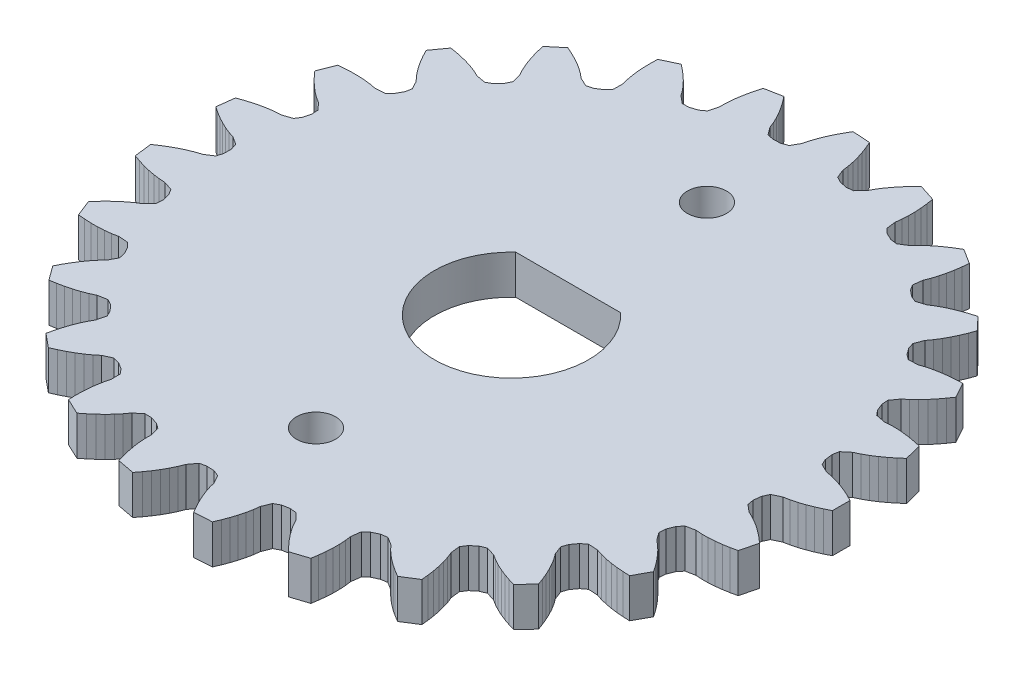
from build123d import *

# Parameters (mm, degrees)
EXTRUDE_1_DEPTH     = 2
SKETCH_2_R          = 1
CUT_EXTRUDE_1_DEPTH = 10


with BuildPart() as part:
    # Эскиз1 → Бобышка-Вытянуть1 (new body)
    with BuildSketch(Plane(origin=(0, 0, 0), x_dir=(1, 0, 0), z_dir=(0, 1, 0))):
        Polygon((32.943136139, 20.331579673), (33.080956161, 20.030160949), (33.512868966, 19.822081617), (33.823960281, 19.763235506), (34.136151921, 19.680300027), (34.448821434, 19.576608948), (34.761457482, 19.454041868), (35.073598037, 19.313820932), (35.384807371, 19.156809673), (35.384807371, 18.257142019), (35.073598037, 18.10013076), (34.761457482, 17.959909824), (34.448821434, 17.837342744), (34.136151921, 17.733651665), (33.823960281, 17.650716186), (33.512868966, 17.591870075), (33.080956161, 17.383790743), (32.943136139, 17.082372019), (32.893897512, 16.692608156), (32.952427876, 16.36638461), (33.319024121, 16.057430126), (33.605707497, 15.92306751), (33.887465848, 15.765098698), (34.164525351, 15.586907519), (34.436858169, 15.390441685), (34.704320726, 15.176999849), (34.966705734, 14.947526773), (34.742967486, 14.076123833), (34.402488254, 14.001439985), (34.06528264, 13.943250547), (33.731987435, 13.90228356), (33.403354086, 13.879607874), (33.080345306, 13.876916869), (32.764393064, 13.897284781), (32.294302368, 13.803154991), (32.085852427, 13.545480336), (31.941230392, 13.18020677), (31.91679342, 12.849676226), (32.195038514, 12.459259337), (32.439300581, 12.257822713), (32.672921728, 12.034746329), (32.896962554, 11.793251457), (33.111880469, 11.535231541), (33.317859372, 11.26198014), (33.514933439, 10.974463884), (33.081515241, 10.186079109), (32.733159672, 10.198415334), (32.392076868, 10.22591365), (32.059064669, 10.269120864), (31.735116728, 10.328885366), (31.421586637, 10.406607921), (31.120625909, 10.504910065), (30.64189485, 10.530644337), (30.375912666, 10.332904398), (30.144994356, 10.01507261), (30.039125513, 9.701003519), (30.211536293, 9.253655553), (30.398029167, 8.997801926), (30.568833836, 8.72363468), (30.725778675, 8.434010126), (30.869777605, 8.130648468), (31.001330441, 7.814756891), (31.120710679, 7.48726316), (30.50484579, 6.831433665), (30.170502346, 6.930014832), (29.846973838, 7.041473082), (29.535169028, 7.166139628), (29.236261334, 7.304589095), (28.951910181, 7.457841617), (28.684851437, 7.627901307), (28.227560448, 7.771882663), (27.92075866, 7.646502166), (27.618053522, 7.396082698), (27.437404936, 7.118209175), (27.4931482, 6.642038651), (27.610153847, 6.347844244), (27.707409752, 6.039813072), (27.787397182, 5.720257012), (27.851429145, 5.39061494), (27.900289966, 5.051931819), (27.934475275, 4.705038247), (27.174860751, 4.222972212), (26.875537461, 4.401604103), (26.589891736, 4.590018956), (26.318886156, 4.788311576), (26.063800179, 4.996746719), (25.826494792, 5.215899787), (25.610118315, 5.447031548), (25.20300067, 5.70021311), (24.874656764, 5.655070174), (24.519184874, 5.4877978), (24.275107362, 5.263579662), (24.210680554, 4.788506124), (24.25084708, 4.474456254), (24.268443274, 4.151915888), (24.266447392, 3.822507204), (24.246489023, 3.487297343), (24.209587725, 3.147103382), (24.156430116, 2.80260657), (23.300795331, 2.524593975), (23.055299777, 2.772052493), (22.825485006, 3.02558515), (22.612306934, 3.285044389), (22.417070665, 3.550368462), (22.241721815, 3.821651883), (22.089623335, 4.099332857), (21.758259733, 4.445806295), (21.429004762, 4.483737417), (21.043101728, 4.410122476), (20.750931576, 4.253648172), (20.57038287, 3.809522238), (20.531186464, 3.495349814), (20.468017314, 3.178566651), (20.384163528, 2.860003302), (20.281468886, 2.54028812), (20.161124112, 2.219958957), (20.023963674, 1.899504906), (19.126071308, 1.843014306), (18.949828879, 2.143750721), (18.79028517, 2.446470793), (18.648329368, 2.750793874), (18.525210219, 3.056335589), (18.422835719, 3.362703628), (18.344572142, 3.669486097), (18.109783377, 4.087481212), (17.800305643, 4.206103039), (17.408219172, 4.230771029), (17.086314505, 4.151872415), (16.800988441, 3.766600152), (16.684891956, 3.472045782), (16.544926613, 3.180924473), (16.384483764, 2.893222967), (16.20550553, 2.609091344), (16.009278985, 2.328754439), (15.796734013, 2.052478454), (14.913001946, 2.221059362), (14.817086602, 2.556177299), (14.737838672, 2.88906377), (14.676024746, 3.219128954), (14.632758746, 3.545690002), (14.609791162, 3.867892429), (14.610280077, 4.184500123), (14.486818791, 4.647752744), (14.216563918, 4.839611831), (13.842930243, 4.961012771), (13.511517516, 4.964647337), (13.139342179, 4.662436817), (12.953640387, 4.406008436), (12.745673386, 4.158841204), (12.518722689, 3.920078883), (12.274706725, 3.689383854), (12.014928044, 3.466653807), (11.740353519, 3.251915325), (10.926309888, 3.634975182), (10.916748343, 3.983417949), (10.922775631, 4.325554338), (10.944987576, 4.660622416), (10.984293287, 4.987683764), (11.042175757, 5.305475415), (11.121386444, 5.612014708), (11.117010163, 6.091416969), (10.902959259, 6.344458104), (10.571255159, 6.554963927), (10.251158252, 6.6409033), (9.815518788, 6.440743522), (9.571880013, 6.238553467), (9.308978688, 6.050870738), (9.02978029, 5.876049919), (8.736059014, 5.713286901), (8.429051048, 5.562158658), (8.109699499, 5.422450488), (7.416493657, 5.995920234), (7.493886698, 6.33579389), (7.584810488, 6.66568251), (7.689652646, 6.984699922), (7.809060346, 7.291711104), (7.944155902, 7.58512396), (8.097111261, 7.862333861), (8.212094964, 8.327763155), (8.067697633, 8.626086833), (7.798765297, 8.912470683), (7.510097076, 9.075314977), (7.038366314, 8.989782716), (6.752099278, 8.854535333), (6.450782684, 8.738129903), (6.136879647, 8.638235219), (5.811908649, 8.553631211), (5.476961837, 8.483600716), (5.132899295, 8.427701237), (4.604087916, 9.155547658), (4.763572653, 9.465496692), (4.933679869, 9.762409427), (5.114564622, 10.045331136), (5.306571486, 10.313001509), (5.510391576, 10.563599363), (5.72748086, 10.794061754), (5.954599697, 11.216273447), (5.888928957, 11.541134894), (5.699666392, 11.885402221), (5.460564943, 12.114919329), (4.982383462, 12.149388891), (4.671475374, 12.08958227), (4.350676342, 12.051768321), (4.021792348, 12.033076523), (3.685990751, 12.031947506), (3.344151033, 12.047415033), (2.996996213, 12.078836613), (2.66580646, 12.915326443), (2.897361882, 13.175875617), (3.135964061, 13.421156348), (3.381525755, 13.650205342), (3.634067285, 13.861716194), (3.893805144, 14.05375306), (4.161387835, 14.222987141), (4.486371095, 14.575452119), (4.503553277, 14.906439096), (4.405852547, 15.286958318), (4.231341494, 15.568726836), (3.776755194, 15.721032372), (3.460741554, 15.740424383), (3.140617067, 15.783577904), (2.817417108, 15.847263466), (2.49188456, 15.929680381), (2.164630983, 16.029674048), (1.836196899, 16.146442354), (1.723438643, 17.03901586), (2.012515269, 17.233793911), (2.30462016, 17.412030748), (2.59942925, 17.572815037), (2.896637333, 17.714876361), (3.195972677, 17.836285857), (3.49723557, 17.933658029), (3.899663359, 18.194229622), (3.998618845, 18.510544999), (3.998618845, 18.903406693), (3.899663359, 19.21972207), (3.49723557, 19.480293663), (3.195972677, 19.577665835), (2.896637333, 19.699075331), (2.59942925, 19.841136655), (2.30462016, 20.001920944), (2.012515269, 20.180157781), (1.723438643, 20.374935832), (1.836196899, 21.267509338), (2.164630983, 21.384277644), (2.49188456, 21.484271311), (2.817417108, 21.566688226), (3.140617067, 21.630373789), (3.460741554, 21.673527309), (3.776755194, 21.69291932), (4.231341494, 21.845224856), (4.405852547, 22.126993375), (4.503553277, 22.507512597), (4.486371095, 22.838499573), (4.161387835, 23.190964551), (3.893805144, 23.360198632), (3.634067285, 23.552235499), (3.381525755, 23.76374635), (3.135964061, 23.992795344), (2.897361882, 24.238076075), (2.66580646, 24.498625249), (2.996996213, 25.335115079), (3.344151033, 25.366536659), (3.685990751, 25.382004186), (4.021792348, 25.38087517), (4.350676342, 25.362183371), (4.671475374, 25.324369422), (4.982383462, 25.264562801), (5.460564943, 25.299032363), (5.699666392, 25.528549471), (5.888928957, 25.872816799), (5.954599697, 26.197678245), (5.72748086, 26.619889938), (5.510391576, 26.850352329), (5.306571486, 27.100950183), (5.114564622, 27.368620556), (4.933679869, 27.651542265), (4.763572653, 27.948455), (4.604087916, 28.258404034), (5.132899295, 28.986250456), (5.476961837, 28.930350976), (5.811908649, 28.860320481), (6.136879647, 28.775716474), (6.450782684, 28.675821789), (6.752099278, 28.55941636), (7.038366314, 28.424168977), (7.510097076, 28.338636715), (7.798765297, 28.501481009), (8.067697633, 28.787864859), (8.212094964, 29.086188537), (8.097111261, 29.551617831), (7.944155902, 29.828827732), (7.809060346, 30.122240589), (7.689652646, 30.42925177), (7.584810488, 30.748269183), (7.493886698, 31.078157802), (7.416493657, 31.418031459), (8.109699499, 31.991501204), (8.429051048, 31.851793034), (8.736059014, 31.700664791), (9.02978029, 31.537901774), (9.308978688, 31.363080954), (9.571880013, 31.175398225), (9.815518788, 30.97320817), (10.251158252, 30.773048392), (10.571255159, 30.858987766), (10.902959259, 31.069493588), (11.117010163, 31.322534723), (11.121386444, 31.801936985), (11.042175757, 32.108476277), (10.984293287, 32.426267928), (10.944987576, 32.753329277), (10.922775631, 33.088397355), (10.916748343, 33.430533744), (10.926309888, 33.778976511), (11.740353519, 34.162036367), (12.014928044, 33.947297886), (12.274706725, 33.724567838), (12.518722689, 33.493872809), (12.745673386, 33.255110488), (12.953640387, 33.007943257), (13.139342179, 32.751514875), (13.511517516, 32.449304355), (13.842930243, 32.452938921), (14.216563918, 32.574339861), (14.486818791, 32.766198949), (14.610280077, 33.22945157), (14.609791162, 33.546059263), (14.632758746, 33.86826169), (14.676024746, 34.194822738), (14.737838672, 34.524887922), (14.817086602, 34.857774393), (14.913001946, 35.19289233), (15.796734013, 35.361473238), (16.009278985, 35.085197253), (16.20550553, 34.804860349), (16.384483764, 34.520728726), (16.544926613, 34.233027219), (16.684891956, 33.941905911), (16.800988441, 33.64735154), (17.086314505, 33.262079277), (17.408219172, 33.183180663), (17.800305643, 33.207848653), (18.109783377, 33.32647048), (18.344572142, 33.744465595), (18.422835719, 34.051248064), (18.525210219, 34.357616103), (18.648329368, 34.663157818), (18.79028517, 34.9674809), (18.949828879, 35.270200971), (19.126071308, 35.570937386), (20.023963674, 35.514446787), (20.161124112, 35.193992735), (20.281468886, 34.873663572), (20.384163528, 34.55394839), (20.468017314, 34.235385041), (20.531186464, 33.918601879), (20.57038287, 33.604429454), (20.750931576, 33.16030352), (21.043101728, 33.003829216), (21.429004762, 32.930214275), (21.758259733, 32.968145397), (22.089623335, 33.314618836), (22.241721815, 33.592299809), (22.417070665, 33.86358323), (22.612306934, 34.128907303), (22.825485006, 34.388366543), (23.055299777, 34.6418992), (23.300795331, 34.889357717), (24.156430116, 34.611345123), (24.209587725, 34.26684831), (24.246489023, 33.926654349), (24.266447392, 33.591444488), (24.268443274, 33.262035804), (24.25084708, 32.939495438), (24.210680554, 32.625445568), (24.275107362, 32.15037203), (24.519184874, 31.926153892), (24.874656764, 31.758881518), (25.20300067, 31.713738582), (25.610118315, 31.966920144), (25.826494792, 32.198051905), (26.063800179, 32.417204973), (26.318886156, 32.625640116), (26.589891736, 32.823932736), (26.875537461, 33.012347589), (27.174860751, 33.19097948), (27.934475275, 32.708913445), (27.900289966, 32.362019874), (27.851429145, 32.023336752), (27.787397182, 31.69369468), (27.707409752, 31.37413862), (27.610153847, 31.066107449), (27.4931482, 30.771913041), (27.437404936, 30.295742517), (27.618053522, 30.017868995), (27.92075866, 29.767449526), (28.227560448, 29.642069029), (28.684851437, 29.786050385), (28.951910181, 29.956110076), (29.236261334, 30.109362597), (29.535169028, 30.247812064), (29.846973838, 30.37247861), (30.170502346, 30.48393686), (30.50484579, 30.582518027), (31.120710679, 29.926688532), (31.001330441, 29.599194801), (30.869777605, 29.283303224), (30.725778675, 28.979941567), (30.568833836, 28.690317013), (30.398029167, 28.416149767), (30.211536293, 28.160296139), (30.039125513, 27.712948173), (30.144994356, 27.398879082), (30.375912666, 27.081047295), (30.64189485, 26.883307355), (31.120625909, 26.909041627), (31.421586637, 27.007343771), (31.735116728, 27.085066326), (32.059064669, 27.144830828), (32.392076868, 27.188038042), (32.733159672, 27.215536359), (33.081515241, 27.227872583), (33.514933439, 26.439487808), (33.317859372, 26.151971553), (33.111880469, 25.878720151), (32.896962554, 25.620700235), (32.672921728, 25.379205363), (32.439300581, 25.156128979), (32.195038514, 24.954692356), (31.91679342, 24.564275466), (31.941230392, 24.233744923), (32.085852427, 23.868471357), (32.294302368, 23.610796702), (32.764393064, 23.516666911), (33.080345306, 23.537034823), (33.403354086, 23.534343818), (33.731987435, 23.511668132), (34.06528264, 23.470701145), (34.402488254, 23.412511707), (34.742967486, 23.33782786), (34.966705734, 22.466424919), (34.704320726, 22.236951843), (34.436858169, 22.023510007), (34.164525351, 21.827044173), (33.887465848, 21.648852995), (33.605707497, 21.490884182), (33.319024121, 21.356521566), (32.952427876, 21.047567082), (32.893897512, 20.721343536), align=None)
    extrude(amount=EXTRUDE_1_DEPTH)

    # Эскиз2 → Вырез-Вытянуть1 (cut)
    with BuildSketch(Plane(origin=(0, 2, 0), x_dir=(1, 0, 0), z_dir=(0, 1, 0))):
        with Locations(Location((18.515804006, 28.706975846, 0), (0, 0, 270))):
            Circle(SKETCH_2_R)
        with Locations(Location((18.515804006, 8.706975846, 0), (0, 0, 270))):
            Circle(SKETCH_2_R)
        with BuildLine():
            Line((15.833920339, 21.606975846), (21.197687672, 21.606975846))
            ThreePointArc((21.197687672, 21.606975846), (18.515804006, 14.756975846), (15.833920339, 21.606975846))
        make_face()
    extrude(amount=-CUT_EXTRUDE_1_DEPTH, mode=Mode.SUBTRACT)


solid = part.part
